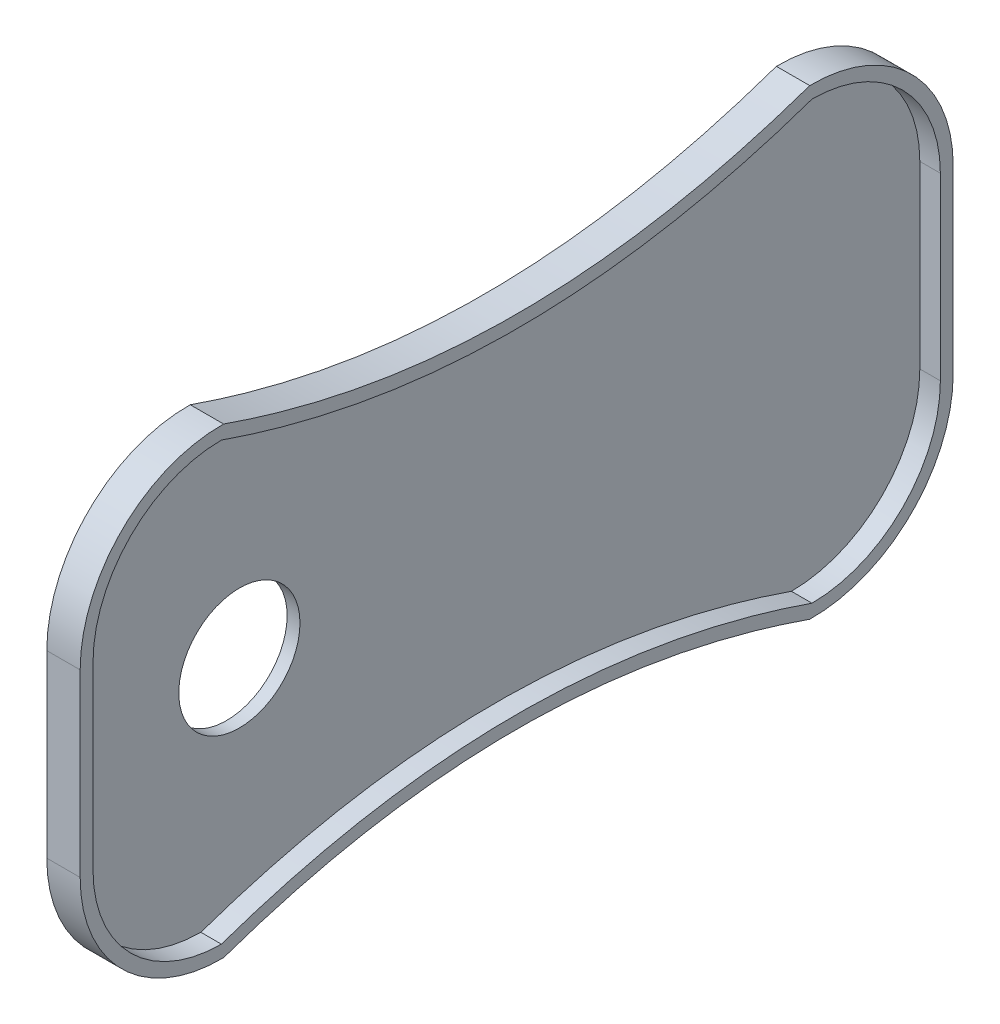
from build123d import *

# Parameters (mm, degrees)
CROQUIS1_R              = 23.6
SALIENTE_EXTRUIR1_DEPTH = 8
VACIADO1_T              = 5
CORTAR_EXTRUIR1_START   = -214
CROQUIS2_R              = 23.6
CORTAR_EXTRUIR1_DEPTH   = 214


with BuildPart() as part:
    # Croquis1 → Saliente-Extruir1 (new body)
    with BuildSketch(Plane(origin=(0, 0, 0), x_dir=(0, 0, -1), z_dir=(1, 0, 0))):
        with BuildLine():
            Line((165, -35), (165, 35))
            ThreePointArc((165, 35), (150.355339059, 70.355339059), (115, 85))
            add(Edge.make_bspline(
                [(-115, 85), (0, 45), (115, 85)],
                knots=[0, 0, 0, 1, 1, 1], degree=2))
            ThreePointArc((-115, 85), (-150.355339059, 70.355339059), (-165, 35))
            Line((-165, 35), (-165, -35))
            ThreePointArc((-165, -35), (-150.355339059, -70.355339059), (-115, -85))
            add(Edge.make_bspline(
                [(-115, -85), (0, -45), (115, -85)],
                knots=[0, 0, 0, 1, 1, 1], degree=2))
            ThreePointArc((115, -85), (150.355339059, -70.355339059), (165, -35))
        make_face()
        with Locations((-100, 0)):
            Circle(CROQUIS1_R, mode=Mode.SUBTRACT)
    extrude(amount=SALIENTE_EXTRUIR1_DEPTH)

    # Vaciado1
    vaciado1_openings = [part.faces().sort_by_distance(p)[0] for p in [
        (8, 0, -3.797931414),
    ]]
    offset(amount=VACIADO1_T, openings=vaciado1_openings, kind=Kind.INTERSECTION)

    # Croquis2 → Cortar-Extruir1 (cut)
    with BuildSketch(Plane(origin=(8, 0, 0), x_dir=(0, 0, -1), z_dir=(1, 0, 0)).offset(CORTAR_EXTRUIR1_START)):
        with Locations((-100, 0)):
            Circle(CROQUIS2_R)
    extrude(amount=CORTAR_EXTRUIR1_DEPTH, mode=Mode.SUBTRACT)


solid = part.part
